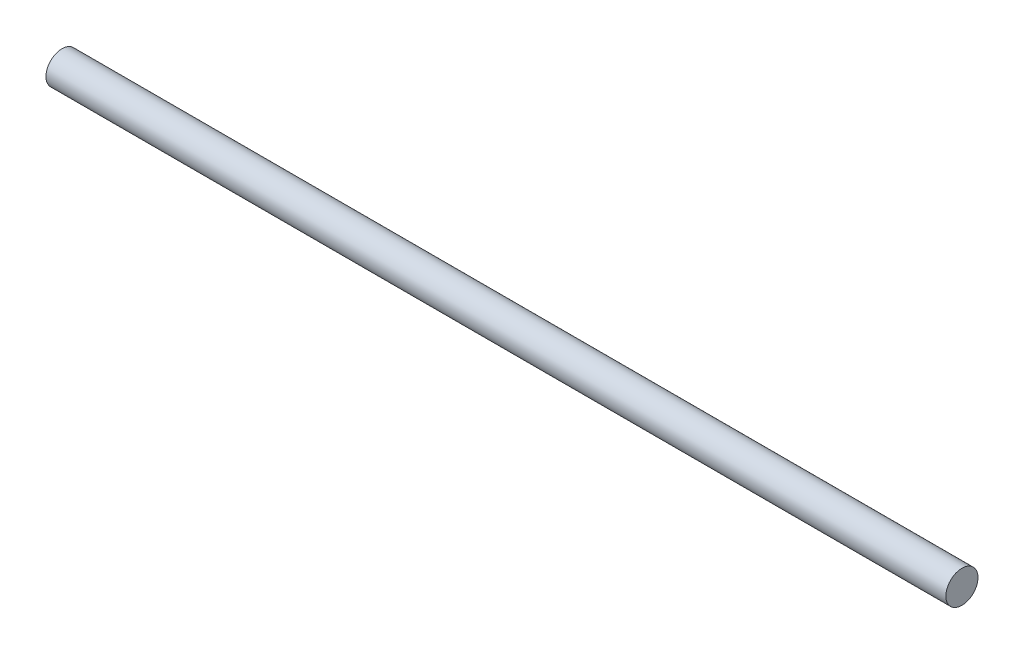
from build123d import *

# Parameters (mm, degrees)
SKETCH1_R           = 2.5
BOSS_EXTRUDE1_DEPTH = 140


with BuildPart() as part:
    # Sketch1 → Boss-Extrude1 (new body)
    with BuildSketch(Plane(origin=(0, 0, 0), x_dir=(0, 0, -1), z_dir=(1, 0, 0))):
        Circle(SKETCH1_R)
    extrude(amount=BOSS_EXTRUDE1_DEPTH)


solid = part.part
